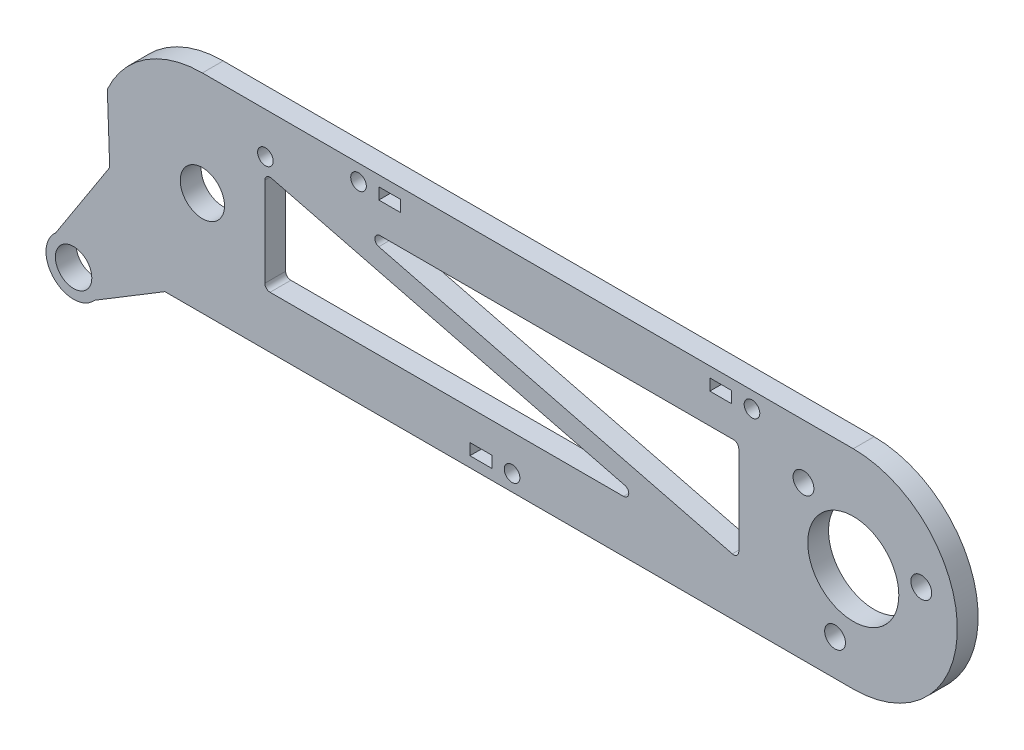
from build123d import *

# Parameters (mm, degrees)
SKETCH_1_R      = 4.25
SKETCH_1_R_2    = 8.75
SKETCH_1_R_3    = 2
SKETCH_1_R_4    = 1.5
SKETCH_1_R_5    = 3.5
SKETCH_1_W      = 4.2
SKETCH_1_H      = 2.2
EXTRUDE_1_DEPTH = 4


with BuildPart() as part:
    # 草图1 → 凸台-拉伸1 (new body)
    with BuildSketch(Plane.XY):
        with BuildLine():
            Line((-1, 20), (124.064295006, 20))
            ThreePointArc((124.064295006, 20), (144.064295006, 0), (124.064295006, -20))
            Line((124.064295006, -20), (10.014533743, -20))
            Line((10.014533743, -20), (-8.201544029, -20))
            Line((-8.201544029, -20), (-21.728077025, -28.201893958))
            ThreePointArc((-21.728077025, -28.201893958), (-29.496403282, -28.496403282), (-29.201893958, -20.728077025))
            Line((-29.201893958, -20.728077025), (-18.809358134, -4.651044611))
            Line((-18.809358134, -4.651044611), (-19.264777912, 8.14848991))
            ThreePointArc((-19.264777912, 8.14848991), (-11.886464114, 16.777511708), (-1, 20))
        make_face()
        with Locations((-1, 0)):
            Circle(SKETCH_1_R, mode=Mode.SUBTRACT)
        with Locations((124.064295006, 0)):
            Circle(SKETCH_1_R_2, mode=Mode.SUBTRACT)
        with Locations((114.497140256, 9.567154749)):
            Circle(SKETCH_1_R_3, mode=Mode.SUBTRACT)
        with Locations((137.133271435, 3.50182168)):
            Circle(SKETCH_1_R_3, mode=Mode.SUBTRACT)
        with Locations((120.562473325, -13.06897643)):
            Circle(SKETCH_1_R_3, mode=Mode.SUBTRACT)
        with Locations(Location((29, 16.9, 0), (0, 0, 180))):
            Circle(SKETCH_1_R_4, mode=Mode.SUBTRACT)
        with Locations(Location((104.6, 16.9, 0), (0, 0, 180))):
            Circle(SKETCH_1_R_4, mode=Mode.SUBTRACT)
        with Locations((-25.748737342, -24.748737342)):
            Circle(SKETCH_1_R_5, mode=Mode.SUBTRACT)
        with Locations((11.106307295, 12.106307295)):
            Circle(SKETCH_1_R_4, mode=Mode.SUBTRACT)
        with Locations(Location((58.5, -16.9, 0), (0, 0, 180))):
            Circle(SKETCH_1_R_4, mode=Mode.SUBTRACT)
        with BuildLine():
            Line((32.894135197, 8.030421477), (100.819514517, -9.118068433))
            ThreePointArc((100.819514517, -9.118068433), (101.678794604, -8.937407044), (102.064295006, -8.14848991))
            Line((102.064295006, -8.14848991), (102.064295006, 9))
            ThreePointArc((102.064295006, 9), (101.771401787, 9.707106781), (101.064295006, 10))
            Line((101.064295006, 10), (33.138915685, 10))
            ThreePointArc((33.138915685, 10), (32.146550197, 9.123331822), (32.894135197, 8.030421477))
        make_face(mode=Mode.SUBTRACT)
        with BuildLine():
            Line((12.244780488, 9.118068433), (80.170159809, -8.030421477))
            ThreePointArc((80.170159809, -8.030421477), (80.917744808, -9.123331822), (79.925379321, -10))
            Line((79.925379321, -10), (12, -10))
            ThreePointArc((12, -10), (11.292893219, -9.707106781), (11, -9))
            Line((11, -9), (11, 8.14848991))
            ThreePointArc((11, 8.14848991), (11.385500402, 8.937407044), (12.244780488, 9.118068433))
        make_face(mode=Mode.SUBTRACT)
        with Locations((35, 16.9)):
            Rectangle(SKETCH_1_W, SKETCH_1_H, mode=Mode.SUBTRACT)
        with Locations((98.6, 16.9)):
            Rectangle(SKETCH_1_W, SKETCH_1_H, mode=Mode.SUBTRACT)
        with Locations((52.5, -16.9)):
            Rectangle(SKETCH_1_W, SKETCH_1_H, mode=Mode.SUBTRACT)
    extrude(amount=EXTRUDE_1_DEPTH)


solid = part.part
